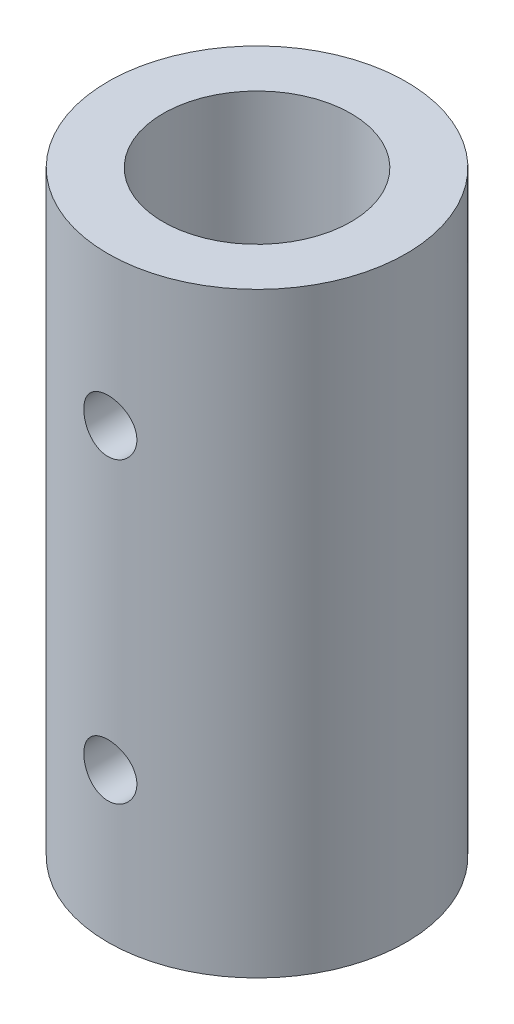
from build123d import *

# Parameters (mm, degrees)
SKETCH1_R               = 6.35
BOSS_EXTRUDE1_DEPTH     = 25.4
CUT_EXTRUDE2_DEPTH      = 27.940768363
CUT_EXTRUDE2_DEPTH_BACK = 12.7
SKETCH3_R               = 4
SKETCH6_R               = 4.0005
CUT_EXTRUDE5_DEPTH      = 27.940768363
CUT_EXTRUDE3_REACH      = 31.099
CUT_EXTRUDE3_END_RADIUS = 4.0005
SKETCH4_R               = 1.1303


with BuildPart() as part:
    # Sketch1 → Boss-Extrude1 (new body)
    with BuildSketch(Plane(origin=(0, 0, 0), x_dir=(1, 0, 0), z_dir=(0, 1, 0))):
        with Locations(Location((0, 0, 0), (0, 0, 270))):
            Circle(SKETCH1_R)
    extrude(amount=BOSS_EXTRUDE1_DEPTH)

    # Sketch3 → Cut-Extrude2 (cut, two sides: drawn at the far end of the back side and taken through both)
    with BuildSketch(Plane.XZ.offset(-CUT_EXTRUDE2_DEPTH_BACK)):
        with Locations(Location((0, 0, 0), (0, 0, 90))):
            Circle(SKETCH3_R)
    extrude(amount=CUT_EXTRUDE2_DEPTH + CUT_EXTRUDE2_DEPTH_BACK, mode=Mode.SUBTRACT)

    # Sketch6 → Cut-Extrude5 (cut, through all)
    with BuildSketch(Plane(origin=(0, 0, 0), x_dir=(-1, 0, 0), z_dir=(0, -1, 0))):
        with Locations(Location((0, 0, 0), (0, 0, 90))):
            Circle(SKETCH6_R)
    extrude(amount=-CUT_EXTRUDE5_DEPTH, mode=Mode.SUBTRACT)

    # Cut-Extrude3: up to this cylinder (the profile starts outside it)
    cut_extrude3_end = Plane(origin=(0, 12.7, 0), z_dir=(0, -1, 0)) * Cylinder(CUT_EXTRUDE3_END_RADIUS, 83.899, mode=Mode.PRIVATE)
    # Sketch4 → Cut-Extrude3 (cut, up to the surface)
    with BuildSketch(Plane.XY.offset(6.35), mode=Mode.PRIVATE) as cut_extrude3_sk1:
        with Locations((0, 6.35)):
            Circle(SKETCH4_R)
    cut_extrude3_tool1 = extrude(cut_extrude3_sk1.sketch, amount=-CUT_EXTRUDE3_REACH, mode=Mode.PRIVATE) - cut_extrude3_end
    add(cut_extrude3_tool1.solids().sort_by_distance((0, 6.35, 6.35))[0], mode=Mode.SUBTRACT)
    # Sketch4 → Cut-Extrude3 (cut, up to the surface)
    with BuildSketch(Plane.XY.offset(6.35), mode=Mode.PRIVATE) as cut_extrude3_sk2:
        with Locations((0, 19.05)):
            Circle(SKETCH4_R)
    cut_extrude3_tool2 = extrude(cut_extrude3_sk2.sketch, amount=-CUT_EXTRUDE3_REACH, mode=Mode.PRIVATE) - cut_extrude3_end
    add(cut_extrude3_tool2.solids().sort_by_distance((0, 19.05, 6.35))[0], mode=Mode.SUBTRACT)


solid = part.part
